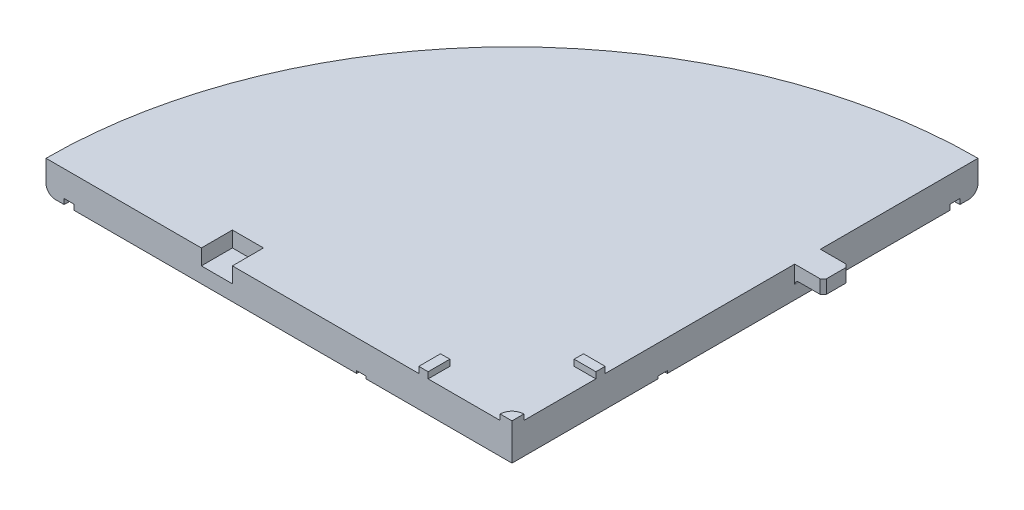
from build123d import *

# Parameters (mm, degrees)
SKETCH1_R           = 150
BOSS_EXTRUDE3_DEPTH = 10
CUT_EXTRUDE2_DEPTH  = 10
BOSS_EXTRUDE4_DEPTH = 1.8
SKETCH6_W           = 3
SKETCH6_H           = 7
BOSS_EXTRUDE5_DEPTH = 2
SKETCH7_W           = 7
SKETCH7_H           = 3
BOSS_EXTRUDE6_DEPTH = 2
SKETCH8_W           = 10
SKETCH8_H           = 10
CUT_EXTRUDE3_DEPTH  = 5
SKETCH9_W           = 9.193751657
SKETCH9_H           = 8.277315045
BOSS_EXTRUDE7_DEPTH = 4.35
CHAMFER1_SIZE       = 1
CUT_EXTRUDE4_DEPTH  = 1.7
CUT_EXTRUDE5_DEPTH  = 0.8
FILLET1_R           = 3
FILLET2_R           = 1.4


with BuildPart() as part:
    # Sketch1 → Boss-Extrude3 (new body)
    with BuildSketch(Plane(origin=(0, 0, 0), x_dir=(1, 0, 0), z_dir=(0, 1, 0))):
        with Locations(Location((0, 0, 0), (0, 0, 270))):
            Circle(SKETCH1_R)
    extrude(amount=BOSS_EXTRUDE3_DEPTH)

    # Sketch4 → Cut-Extrude2 (cut)
    with BuildSketch(Plane(origin=(0, 10, 0), x_dir=(1, 0, 0), z_dir=(0, 1, 0))):
        Polygon((0, 0), (0, 162.329653064), (183.678217859, 162.329653064), (183.678217859, -176.427761891), (-217.916482153, -176.427761891), (-217.916482153, 0), align=None)
    extrude(amount=-CUT_EXTRUDE2_DEPTH, mode=Mode.SUBTRACT)

    # Sketch5 → Boss-Extrude4 (add)
    with BuildSketch(Plane(origin=(0, 10, 0), x_dir=(1, 0, 0), z_dir=(0, 1, 0))):
        with BuildLine():
            Line((0, 3.825), (0, 0))
            Line((0, 0), (-3.825, 0))
            ThreePointArc((-3.825, 0), (-2.704683438, 2.704683438), (0, 3.825))
        make_face()
    extrude(amount=BOSS_EXTRUDE4_DEPTH)

    # Sketch6 → Boss-Extrude5 (add)
    with BuildSketch(Plane(origin=(0, 10, 0), x_dir=(1, 0, 0), z_dir=(0, 1, 0))):
        with Locations((-28.5, 3.5)):
            Rectangle(SKETCH6_W, SKETCH6_H)
    extrude(amount=BOSS_EXTRUDE5_DEPTH)

    # Sketch7 → Boss-Extrude6 (add)
    with BuildSketch(Plane(origin=(0, 10, 0), x_dir=(1, 0, 0), z_dir=(0, 1, 0))):
        with Locations((-3.5, 28.5)):
            Rectangle(SKETCH7_W, SKETCH7_H)
    extrude(amount=BOSS_EXTRUDE6_DEPTH)

    # Sketch8 → Cut-Extrude3 (cut)
    with BuildSketch(Plane(origin=(0, 10, 0), x_dir=(1, 0, 0), z_dir=(0, 1, 0))):
        with Locations((-95, 5)):
            Rectangle(SKETCH8_W, SKETCH8_H)
    extrude(amount=-CUT_EXTRUDE3_DEPTH, mode=Mode.SUBTRACT)

    # Sketch9 → Boss-Extrude7 (add)
    with BuildSketch(Plane(origin=(0, 10, 0), x_dir=(1, 0, 0), z_dir=(0, 1, 0))):
        with Locations((4.596875828, 95.138657523)):
            Rectangle(SKETCH9_W, SKETCH9_H)
    extrude(amount=-BOSS_EXTRUDE7_DEPTH)

    # Chamfer1
    chamfer1_edges = [part.edges().sort_by_distance(p)[0] for p in [
        (9.193751657, 7.825, -99.277315045),
        (9.193751657, 7.825, -91),
    ]]
    chamfer(chamfer1_edges, length=CHAMFER1_SIZE)

    # Sketch10 → Cut-Extrude4 (cut)
    with BuildSketch(Plane.XZ):
        with BuildLine():
            Line((-140.926536809, 0), (-144.178447036, 0))
            ThreePointArc((-144.178447036, 0), (-101.9495576, -101.9495576), (0, -144.178447036))
            Line((0, -144.178447036), (0, -140.926536809))
            ThreePointArc((0, -140.926536809), (-99.650109827, -99.650109827), (-140.926536809, 0))
        make_face()
    extrude(amount=-CUT_EXTRUDE4_DEPTH, mode=Mode.SUBTRACT)

    # Sketch11 → Cut-Extrude5 (cut)
    with BuildSketch(Plane(origin=(0, 0, 0), x_dir=(-1, 0, 0), z_dir=(0, -1, 0))):
        Polygon((47, 0), (50, 0), (50, 50), (0, 50), (0, 47), (47, 47), align=None)
    extrude(amount=-CUT_EXTRUDE5_DEPTH, mode=Mode.SUBTRACT)

    # Fillet1
    fillet1_edges = [part.edges().sort_by_distance(p)[0] for p in [
        (-106.066017178, 0, -106.066017178),
    ]]
    fillet(fillet1_edges, radius=FILLET1_R)

    # Fillet2
    fillet2_edges = [part.edges().sort_by_distance(p)[0] for p in [
        (0, 5.65, -95.138657523),
    ]]
    fillet(fillet2_edges, radius=FILLET2_R)


solid = part.part
